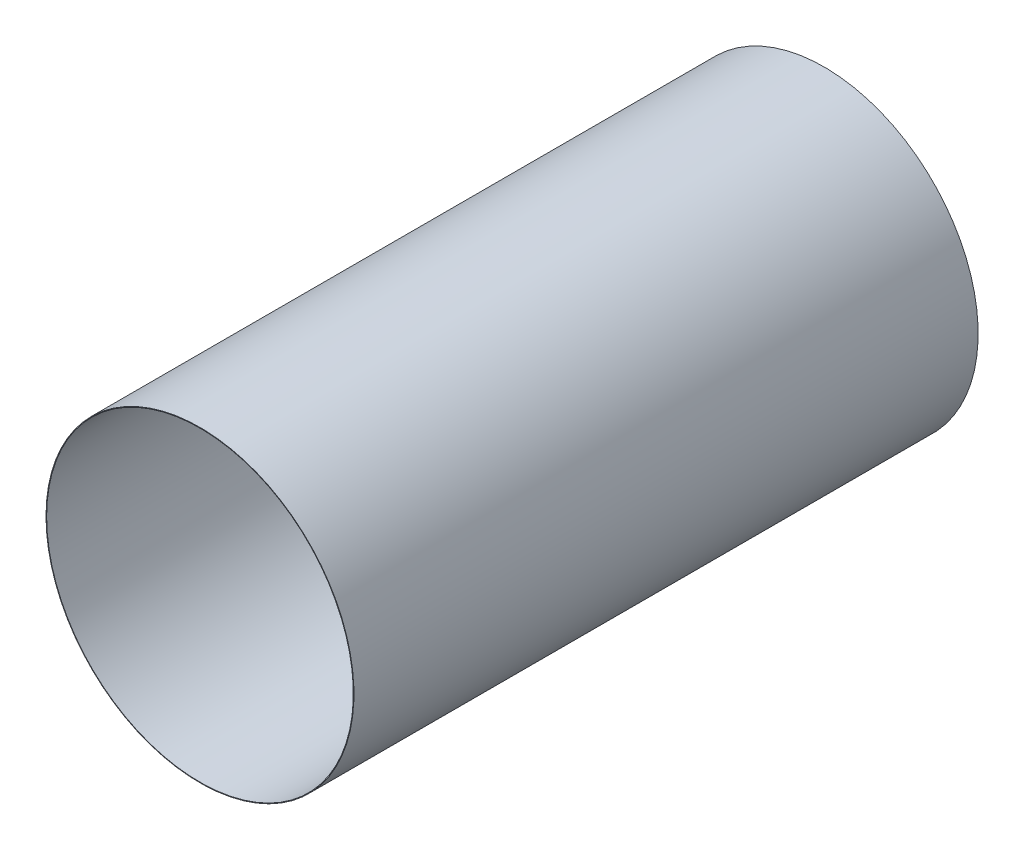
from build123d import *

# Parameters (mm, degrees)
SKETCH1_R           = 51.3
SKETCH1_R_2         = 51.1
BOSS_EXTRUDE1_DEPTH = 208


with BuildPart() as part:
    # Sketch1 → Boss-Extrude1 (new body)
    with BuildSketch(Plane.XY):
        with Locations(Location((0, 0, 0), (0, 0, 180))):
            Circle(SKETCH1_R)
        with Locations(Location((0, 0, 0), (0, 0, 180))):
            Circle(SKETCH1_R_2, mode=Mode.SUBTRACT)
    extrude(amount=BOSS_EXTRUDE1_DEPTH)


solid = part.part
